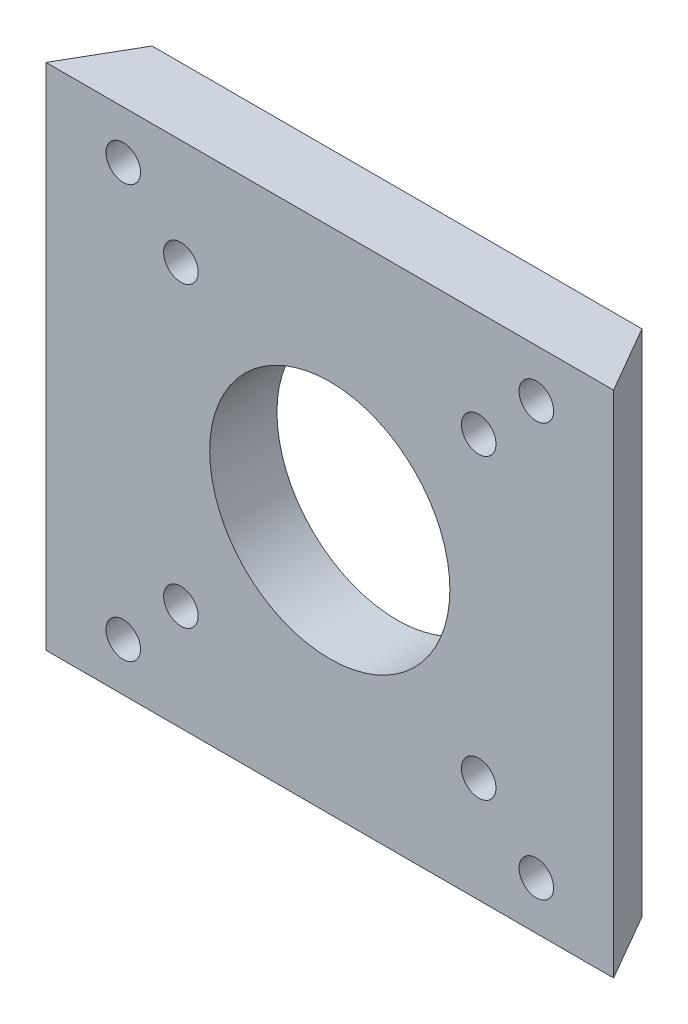
from build123d import *

# Parameters (mm, degrees)
SKETCH1_W               = 51
SKETCH1_H               = 53
BOSS_EXTRUDE1_DEPTH     = 7
CUT_EXTRUDE3_DEPTH      = 38.436613095
CUT_EXTRUDE3_DEPTH_BACK = 10
SKETCH2_R               = 12.5
SKETCH3_R               = 1.8
CUT_EXTRUDE4_DEPTH      = 10
SKETCH4_R               = 1.8
CUT_EXTRUDE5_DEPTH      = 11
BOSS_EXTRUDE2_DEPTH     = 53
SKETCH6_R               = 4
CUT_EXTRUDE6_DEPTH      = 4


with BuildPart() as part:
    # Sketch1 → Boss-Extrude1 (new body)
    with BuildSketch(Plane.XY):
        Rectangle(SKETCH1_W, SKETCH1_H)
    extrude(amount=BOSS_EXTRUDE1_DEPTH)

    # Sketch2 → Cut-Extrude3 (cut, two sides: drawn at the far end of the back side and taken through both)
    with BuildSketch(Plane.XY.offset(-CUT_EXTRUDE3_DEPTH_BACK)):
        with Locations(Location((0, 0, 0), (0, 0, 180))):
            Circle(SKETCH2_R)
    extrude(amount=CUT_EXTRUDE3_DEPTH + CUT_EXTRUDE3_DEPTH_BACK, mode=Mode.SUBTRACT)

    # Sketch3 → Cut-Extrude4 (cut)
    with BuildSketch(Plane.XY.offset(7)):
        with Locations((-15.5, 15.5)):
            Circle(SKETCH3_R)
        with Locations((15.5, 15.5)):
            Circle(SKETCH3_R)
        with Locations((15.5, -15.5)):
            Circle(SKETCH3_R)
        with Locations((-15.5, -15.5)):
            Circle(SKETCH3_R)
    extrude(amount=-CUT_EXTRUDE4_DEPTH, mode=Mode.SUBTRACT)

    # Sketch4 → Cut-Extrude5 (cut)
    with BuildSketch(Plane.XY.offset(7)):
        with Locations((-21.5, 21.5)):
            Circle(SKETCH4_R)
        with Locations((21.5, 21.5)):
            Circle(SKETCH4_R)
        with Locations((21.5, -21.5)):
            Circle(SKETCH4_R)
        with Locations((-21.5, -21.5)):
            Circle(SKETCH4_R)
    extrude(amount=-CUT_EXTRUDE5_DEPTH, mode=Mode.SUBTRACT)

    # Sketch5 → Boss-Extrude2 (add)
    with BuildSketch(Plane(origin=(0, 26.5, 0), x_dir=(1, 0, 0), z_dir=(0, 1, 0))):
        Polygon((-25.5, -7), (-29.541451884, -7), (-25.5, 0), align=None)
        Polygon((25.5, 0), (25.5, -7), (29.541451884, -7), align=None)
    extrude(amount=-BOSS_EXTRUDE2_DEPTH)

    # Sketch6 → Cut-Extrude6 (cut)
    with BuildSketch(Plane(origin=(0, 0, 0), x_dir=(-1, 0, 0), z_dir=(0, 0, -1))):
        with Locations((-15.5, 15.5)):
            Circle(SKETCH6_R)
        with Locations((15.5, 15.5)):
            Circle(SKETCH6_R)
        with Locations((15.5, -15.5)):
            Circle(SKETCH6_R)
        with Locations((-15.5, -15.5)):
            Circle(SKETCH6_R)
    extrude(amount=-CUT_EXTRUDE6_DEPTH, mode=Mode.SUBTRACT)


solid = part.part
